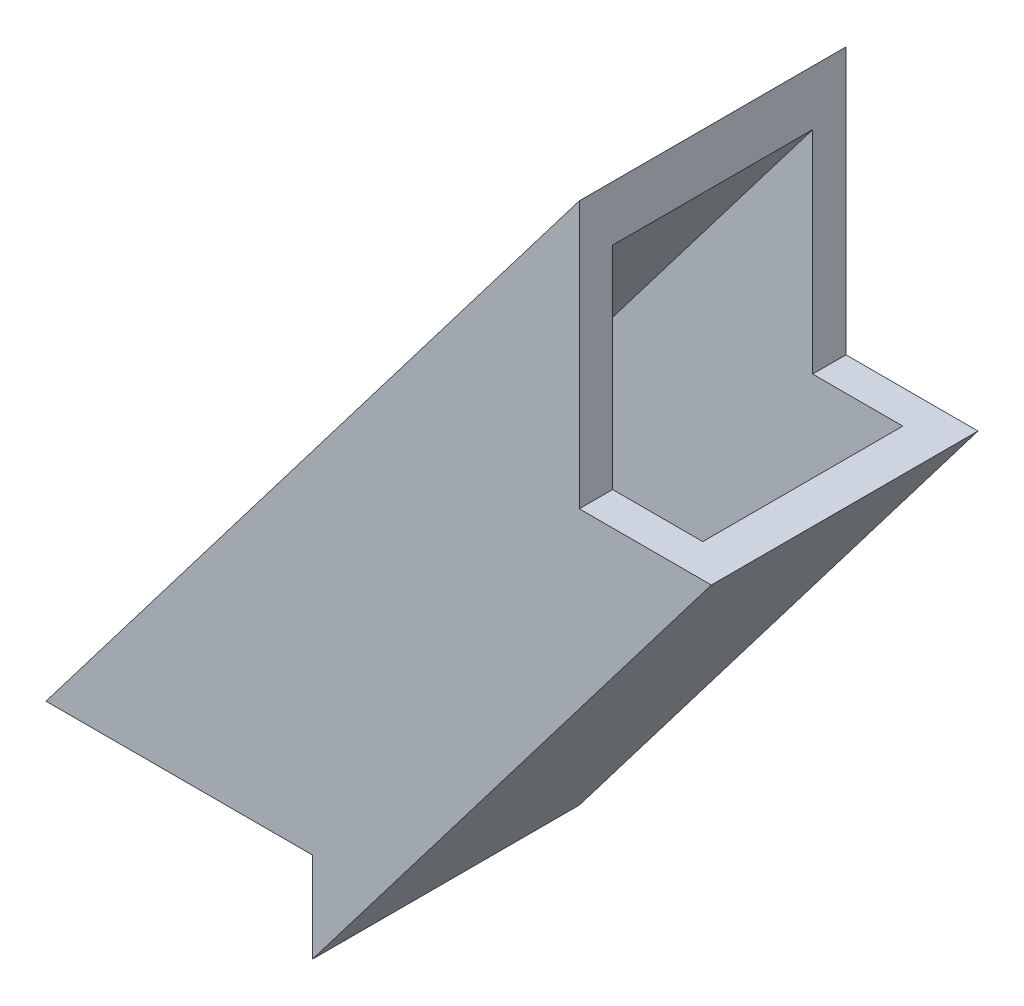
from build123d import *

# Parameters (mm, degrees)
BOSS_EXTRUDE1_DEPTH      = 8.573703
BOSS_EXTRUDE1_DEPTH_BACK = 75.248703
SKETCH1_W                = 25.4
SKETCH1_H                = 25.4
SKETCH1_W_2              = 19.05
SKETCH1_H_2              = 19.05
SKETCH2_W                = 25.4
SKETCH2_H                = 25.4
SKETCH2_H_2              = 50.8
CUT_EXTRUDE1_DEPTH       = 365.478167069


with BuildPart() as part:
    # Sketch1 → Boss-Extrude1 (new, two sides: drawn at the far end of the back side and taken through both)
    with BuildSketch(Plane(origin=(115.396321255, 151.457671647, 0), x_dir=(-0.7954317200324988, 0.606043215262856, 0), z_dir=(-0.606043215262856, -0.7954317200324988, 0)).offset(-BOSS_EXTRUDE1_DEPTH_BACK)):
        with Locations((-209.448142065, -88.9)):
            Rectangle(SKETCH1_W, SKETCH1_H)
        with Locations((-209.448142065, -88.9)):
            Rectangle(SKETCH1_W_2, SKETCH1_H_2, mode=Mode.SUBTRACT)
    extrude(amount=BOSS_EXTRUDE1_DEPTH + BOSS_EXTRUDE1_DEPTH_BACK)

    # Sketch2 → Cut-Extrude1 (cut, through all)
    with BuildSketch(Plane.XY):
        with Locations((330.2, 79.375)):
            Rectangle(SKETCH2_W, SKETCH2_H)
        with Locations((279.4, 0)):
            Rectangle(SKETCH2_W, SKETCH2_H_2)
    extrude(amount=CUT_EXTRUDE1_DEPTH, mode=Mode.SUBTRACT)


solid = part.part
